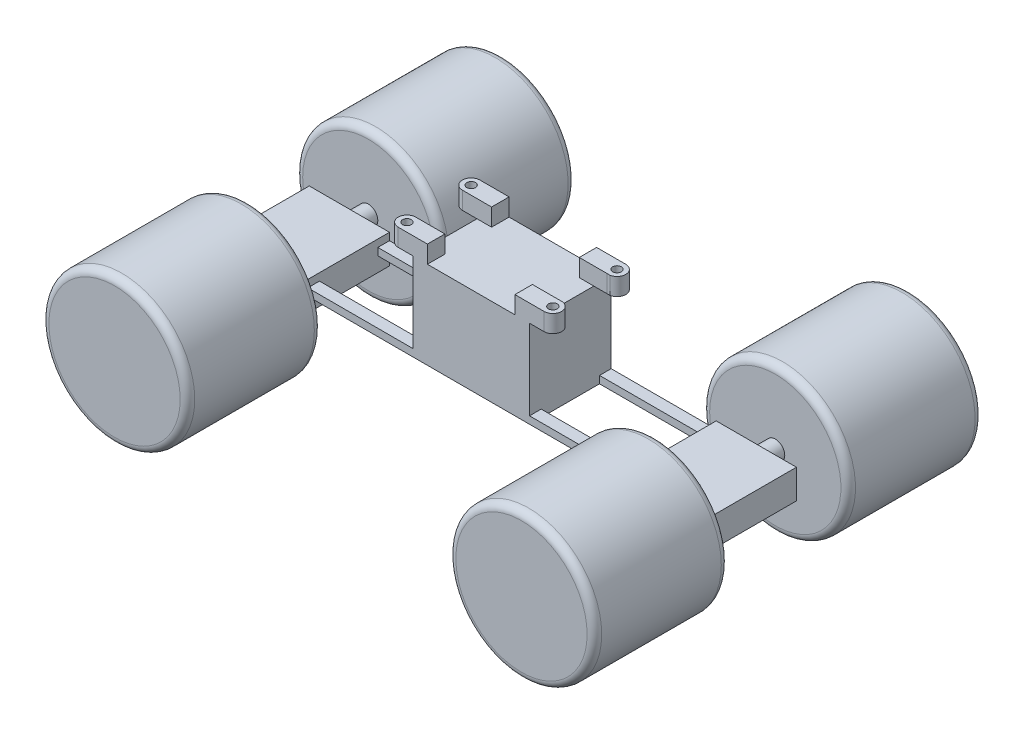
from build123d import *

# Parameters (mm, degrees)
SKETCH1_R             = 3
BOSS_EXTRUDE1_DEPTH   = 12
BOSS_EXTRUDE1_2_DEPTH = 12
BOSS_EXTRUDE1_3_DEPTH = 12
BOSS_EXTRUDE1_4_DEPTH = 12
BOSS_EXTRUDE2_DEPTH   = 60
BOSS_EXTRUDE3_DEPTH   = 8
SKETCH4_W             = 55
SKETCH4_H             = 20
BOSS_EXTRUDE4_DEPTH   = 48
SKETCH5_R             = 6.5
BOSS_EXTRUDE5_DEPTH   = 13
SKETCH6_R             = 50
BOSS_EXTRUDE6_DEPTH   = 92
FILLET2_R             = 5
FILLET2_OF_MIRROR2_R  = 5


with BuildPart() as part:
    # Sketch1 → Boss-Extrude1 (new body)
    with BuildSketch(Plane(origin=(0, 0, 0), x_dir=(1, 0, 0), z_dir=(0, 1, 0))):
        with BuildLine():
            Line((20, 50), (0, 50))
            ThreePointArc((0, 50), (-6, 44), (0, 38))
            Line((0, 38), (20, 38))
            Line((20, 38), (20, 50))
        make_face()
        with Locations(Location((0, 44, 0), (0, 0, 270))):
            Circle(SKETCH1_R, mode=Mode.SUBTRACT)
    extrude(amount=-BOSS_EXTRUDE1_DEPTH)



with BuildPart() as body_2:
    # Sketch1 → Boss-Extrude1 2 (new body)
    with BuildSketch(Plane(origin=(0, 0, 0), x_dir=(1, 0, 0), z_dir=(0, 1, 0))):
        with BuildLine():
            Line((20, 6), (0, 6))
            ThreePointArc((0, 6), (-6, 0), (0, -6))
            Line((0, -6), (20, -6))
            Line((20, -6), (20, 6))
        make_face()
        with Locations(Location((0, 0, 0), (0, 0, 270))):
            Circle(SKETCH1_R, mode=Mode.SUBTRACT)
    extrude(amount=-BOSS_EXTRUDE1_2_DEPTH)


with BuildPart() as body_3:
    # Sketch1 → Boss-Extrude1 3 (new body)
    with BuildSketch(Plane(origin=(0, 0, 0), x_dir=(1, 0, 0), z_dir=(0, 1, 0))):
        with BuildLine():
            ThreePointArc((101.069315555, 38.096055196), (105.975937952, 44.536810571), (100, 50))
            Line((100, 50), (80, 50))
            Line((80, 50), (80, 38.107210431))
            Line((80, 38.107210431), (98.924433311, 38.097190813))
            ThreePointArc((98.924433311, 38.097190813), (98.897618898, 38.102139718), (98.870827252, 38.107210431))
            Line((98.870827252, 38.107210431), (101.069315555, 38.096055196))
        make_face()
        with Locations(Location((100, 44, 0), (0, 0, 270))):
            Circle(SKETCH1_R, mode=Mode.SUBTRACT)
    extrude(amount=-BOSS_EXTRUDE1_3_DEPTH)


with BuildPart() as body_4:
    # Sketch1 → Boss-Extrude1 4 (new body)
    with BuildSketch(Plane(origin=(0, 0, 0), x_dir=(1, 0, 0), z_dir=(0, 1, 0))):
        with BuildLine():
            ThreePointArc((100, -6), (106, 0), (100, 6))
            Line((100, 6), (80, 6))
            Line((80, 6), (80, -6))
            Line((80, -6), (100, -6))
        make_face()
        with Locations(Location((100, 0, 0), (0, 0, 270))):
            Circle(SKETCH1_R, mode=Mode.SUBTRACT)
    extrude(amount=-BOSS_EXTRUDE1_4_DEPTH)


with BuildPart() as part_1:
    add(part.part)

    add(body_2.part)  # Boss-Extrude2 merges body 2

    add(body_3.part)  # Boss-Extrude2 merges body 3

    add(body_4.part)  # Boss-Extrude2 merges body 4
    # Sketch2 → Boss-Extrude2 (add)
    with BuildSketch(Plane.XZ.offset(12)):
        Polygon((20, 6), (10, 6), (10, -50), (90, -50), (90, 6), (80, 6), align=None)
    extrude(amount=BOSS_EXTRUDE2_DEPTH)

    # Sketch3 → Boss-Extrude3 (add)
    with BuildSketch(Plane.XY.offset(6)):
        Polygon((10, -72), (-62, -72), (-62, -82), (-117, -82), (-117, -62), (-62, -62), (-62, -67), (10, -67), align=None)
        Polygon((90, -67), (90, -72), (162, -72), (162, -82), (217, -82), (217, -62), (162, -62), (162, -67), align=None)
    boss_extrude3 = extrude(amount=-BOSS_EXTRUDE3_DEPTH)

    # Mirror1: Boss-Extrude3 across plane
    add(boss_extrude3.mirror(Plane.XY.offset(-22)))

    # Sketch4 → Boss-Extrude4 (add)
    with BuildSketch(Plane.XY.offset(-42)):
        with Locations((-89.5, -72)):
            Rectangle(SKETCH4_W, SKETCH4_H)
        with Locations((189.5, -72)):
            Rectangle(SKETCH4_W, SKETCH4_H)
    extrude(amount=BOSS_EXTRUDE4_DEPTH)

    # Sketch5 → Boss-Extrude5 (add)
    with BuildSketch(Plane.XY.offset(6)):
        with Locations(Location((-89.5, -72, 0), (0, 0, 180))):
            Circle(SKETCH5_R)
        with Locations(Location((189.5, -72, 0), (0, 0, 180))):
            Circle(SKETCH5_R)
    boss_extrude5 = extrude(amount=BOSS_EXTRUDE5_DEPTH)

    # Sketch6 → Boss-Extrude6 (add)
    with BuildSketch(Plane.XY.offset(19)):
        with Locations((-89.5, -72)):
            Circle(SKETCH6_R)
        with Locations((189.5, -72)):
            Circle(SKETCH6_R)
    boss_extrude6 = extrude(amount=BOSS_EXTRUDE6_DEPTH)

    # Fillet2
    fillet2_edges = [part_1.edges().sort_by_distance(p)[0] for p in [
        (-139.5, -72, 19),
        (-139.5, -72, 111),
        (139.5, -72, 19),
        (139.5, -72, 111),
    ]]
    fillet(fillet2_edges, radius=FILLET2_R)

    # Mirror2: Boss-Extrude5, Boss-Extrude6 across plane
    add(boss_extrude5.mirror(Plane.XY.offset(-22)))
    add(boss_extrude6.mirror(Plane.XY.offset(-22)))

    # Fillet2 of Mirror2
    fillet2_of_mirror2_edges = [part_1.edges().sort_by_distance(p)[0] for p in [
        (-139.5, -72, -63),
        (-139.5, -72, -155),
        (139.5, -72, -63),
        (139.5, -72, -155),
    ]]
    fillet(fillet2_of_mirror2_edges, radius=FILLET2_OF_MIRROR2_R)


solid = part_1.part
